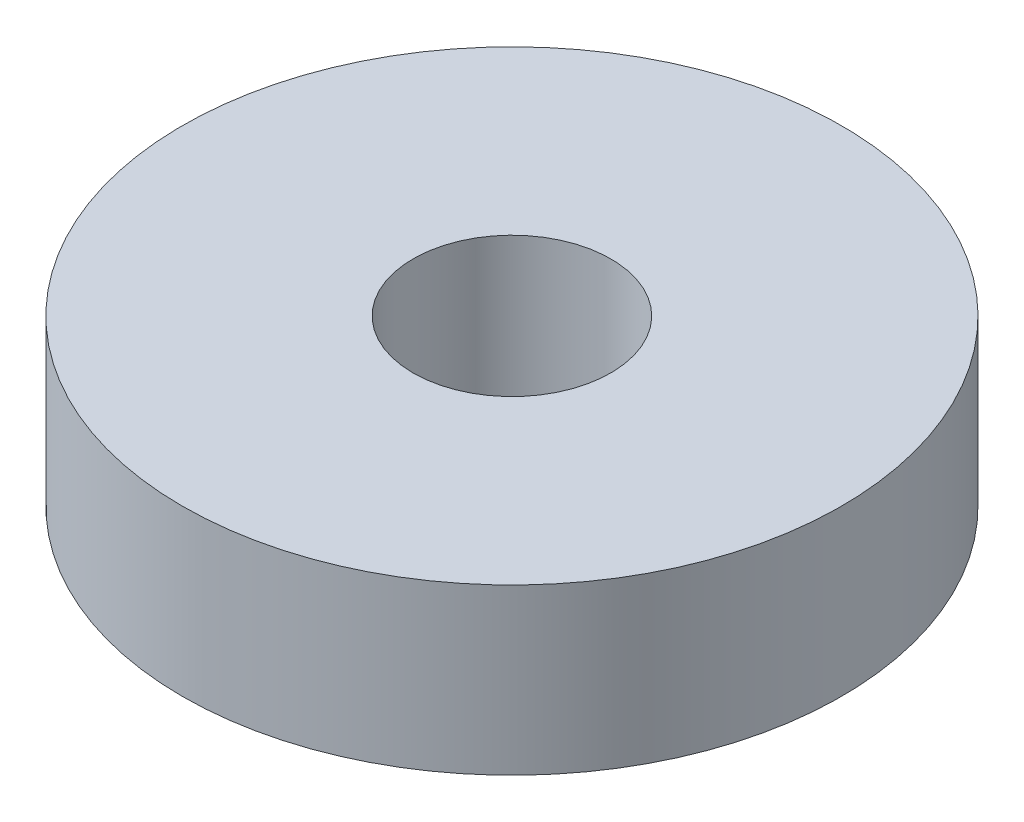
from build123d import *

# Parameters (mm, degrees)
SKETCH_1_R          = 10
EXTRUDE_1_DEPTH     = 5
SKETCH_2_R          = 3
CUT_EXTRUDE_1_DEPTH = 16


with BuildPart() as part:
    # 草图1 → 凸台-拉伸1 (new body)
    with BuildSketch(Plane(origin=(0, 0, 0), x_dir=(1, 0, 0), z_dir=(0, 1, 0))):
        with Locations(Location((0, 0, 0), (0, 0, 270))):
            Circle(SKETCH_1_R)
    extrude(amount=EXTRUDE_1_DEPTH)

    # 草图2 → 切除-拉伸1 (cut, through all)
    with BuildSketch(Plane(origin=(0, 5, 0), x_dir=(1, 0, 0), z_dir=(0, 1, 0))):
        with Locations(Location((0, 0, 0), (0, 0, 270))):
            Circle(SKETCH_2_R)
    extrude(amount=-CUT_EXTRUDE_1_DEPTH, mode=Mode.SUBTRACT)


solid = part.part
